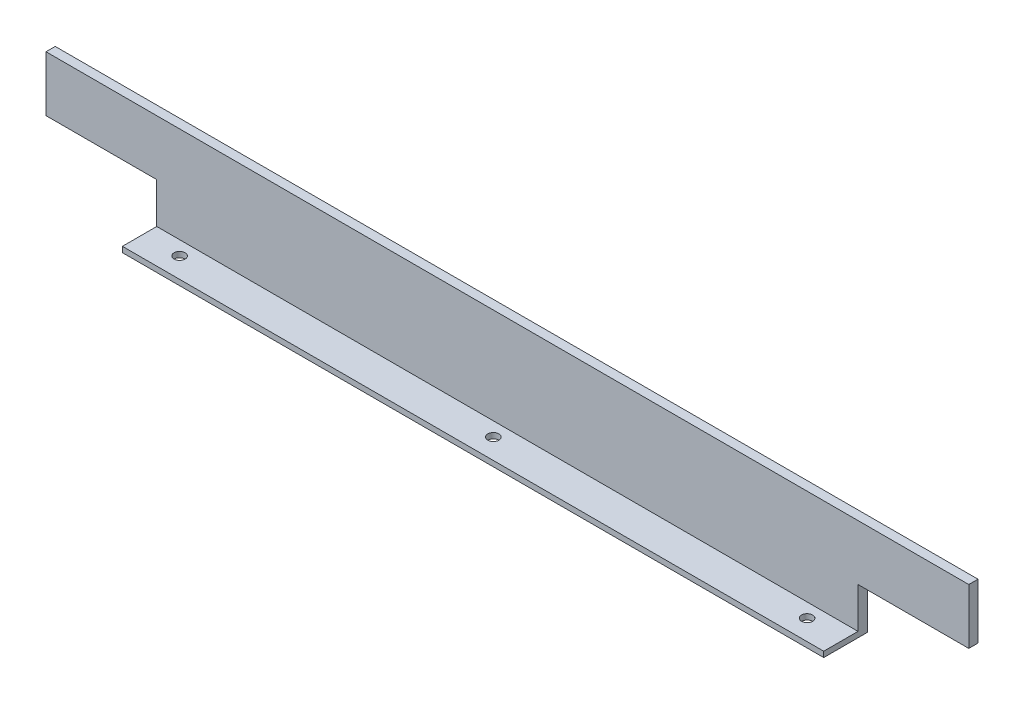
from build123d import *

# Parameters (mm, degrees)
SKETCH_1_W          = 500
SKETCH_1_H          = 55
EXTRUDE_1_DEPTH     = 5
SKETCH_2_W          = 500
SKETCH_2_H          = 5
EXTRUDE_2_DEPTH     = 10
SKETCH_6_W          = 60
SKETCH_6_H          = 25
CUT_EXTRUDE_2_DEPTH = 365.413710539
SKETCH_7_W          = 18.6
SKETCH_7_H          = 3
EXTRUDE_5_DEPTH     = 380
SKETCH_8_R          = 3
CUT_EXTRUDE_3_DEPTH = 338.569517956


with BuildPart() as part:
    # 草图1 → 凸台-拉伸1 (new body)
    with BuildSketch(Plane.XY):
        with Locations((82.704402516, 120.419346185)):
            Rectangle(SKETCH_1_W, SKETCH_1_H)
    extrude(amount=EXTRUDE_1_DEPTH)

    # 草图2 → 凸台-拉伸2 (add)
    with BuildSketch(Plane(origin=(0, 0, 0), x_dir=(-1, 0, 0), z_dir=(0, 0, -1))):
        with Locations((-82.704402516, 115.419346185)):
            Rectangle(SKETCH_2_W, SKETCH_2_H)
    extrude(amount=EXTRUDE_2_DEPTH)

    # 草图6 → 切除-拉伸2 (cut, through all)
    with BuildSketch(Plane.XY.offset(5)):
        with Locations((302.704402516, 105.419346185)):
            Rectangle(SKETCH_6_W, SKETCH_6_H)
        with Locations((-137.295597484, 105.419346185)):
            Rectangle(SKETCH_6_W, SKETCH_6_H)
    extrude(amount=-CUT_EXTRUDE_2_DEPTH, mode=Mode.SUBTRACT)

    # 草图7 → 凸台-拉伸5 (add)
    with BuildSketch(Plane(origin=(272.704402516, 0, 0), x_dir=(0, 0, -1), z_dir=(1, 0, 0))):
        with Locations((-14.3, 94.419346185)):
            Rectangle(SKETCH_7_W, SKETCH_7_H)
    extrude(amount=-EXTRUDE_5_DEPTH)

    # 草图8 → 切除-拉伸3 (cut, through all)
    with BuildSketch(Plane(origin=(0, 95.919346185, 0), x_dir=(1, 0, 0), z_dir=(0, 1, 0))):
        with Locations(Location((-87.295597484, -12.6, 0), (0, 0, 270))):
            Circle(SKETCH_8_R)
        with Locations(Location((82.704402516, -12.6, 0), (0, 0, 270))):
            Circle(SKETCH_8_R)
        with Locations(Location((252.704402516, -12.6, 0), (0, 0, 270))):
            Circle(SKETCH_8_R)
    extrude(amount=-CUT_EXTRUDE_3_DEPTH, mode=Mode.SUBTRACT)


solid = part.part
